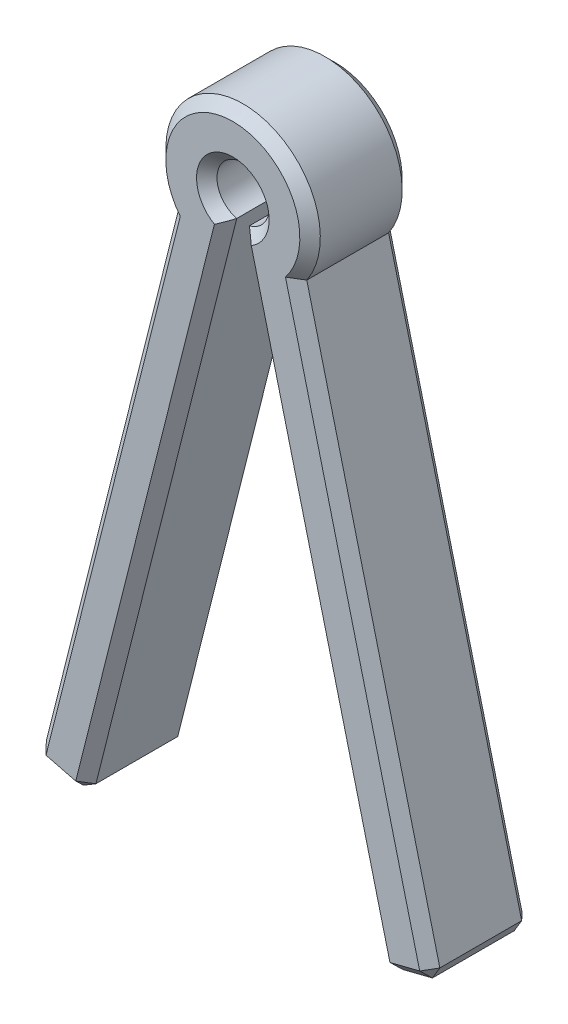
from build123d import *

# Parameters (mm, degrees)
EXTRUDE_1_DEPTH = 10
CHAMFER_1_SIZE  = 1


with BuildPart() as part:
    # 草图1 → 拉伸-薄壁1 (new body)
    with BuildSketch(Plane.XY):
        with BuildLine():
            Line((14.631143099, -58.188741623), (0.621823582, -2.473021519))
            ThreePointArc((0.621823582, -2.473021519), (0, 2.55), (-0.621823582, -2.473021519))
            Line((-0.621823582, -2.473021519), (-14.631143099, -58.188741623))
            Line((-14.631143099, -58.188741623), (-19.480204901, -56.969479698))
            Line((-19.480204901, -56.969479698), (-6.228553085, -4.267039543))
            ThreePointArc((-6.228553085, -4.267039543), (0, 7.55), (6.228553085, -4.267039543))
            Line((6.228553085, -4.267039543), (19.480204901, -56.969479698))
            Line((19.480204901, -56.969479698), (14.631143099, -58.188741623))
        make_face()
    extrude(amount=EXTRUDE_1_DEPTH)

    # 倒角1
    chamfer_1_edges = [part.edges().sort_by_distance(p)[0] for p in [
        (19.480204901, -56.969479698, 5),
        (14.631143099, -58.188741623, 5),
        (-14.631143099, -58.188741623, 5),
        (-7.62648334, -30.330881571, 10),
        (-19.480204901, -56.969479698, 5),
        (0, 2.55, 10),
        (7.62648334, -30.330881571, 10),
        (17.055674, -57.57911066, 10),
        (12.854378993, -30.61825962, 10),
        (0, 7.55, 10),
        (-12.854378993, -30.61825962, 10),
        (0, 7.55, 0),
        (12.854378993, -30.61825962, 0),
        (17.055674, -57.57911066, 0),
        (7.62648334, -30.330881571, 0),
        (0, 2.55, 0),
        (-17.055674, -57.57911066, 10),
        (-7.62648334, -30.330881571, 0),
        (-17.055674, -57.57911066, 0),
        (-12.854378993, -30.61825962, 0),
    ]]
    chamfer(chamfer_1_edges, length=CHAMFER_1_SIZE)


solid = part.part
